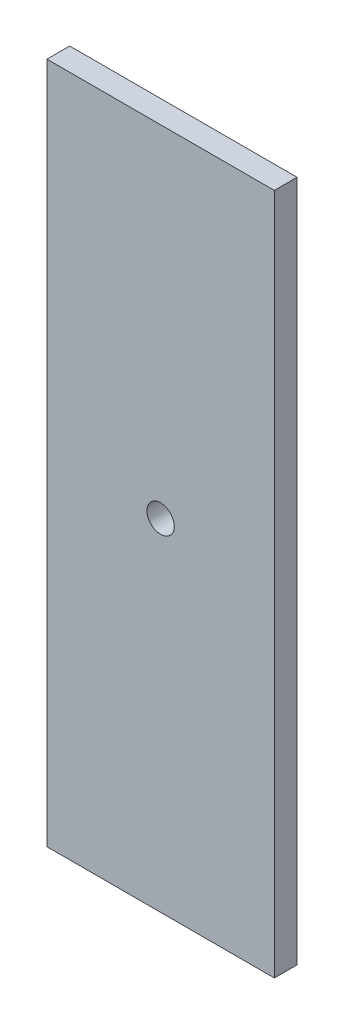
from build123d import *

# Parameters (mm, degrees)
SKETCH1_W           = 50
SKETCH1_H           = 150
BOSS_EXTRUDE1_DEPTH = 5
SKETCH2_R           = 3
CUT_EXTRUDE1_DEPTH  = 80.214897589


with BuildPart() as part:
    # Sketch1 → Boss-Extrude1 (new body)
    with BuildSketch(Plane.XY):
        Rectangle(SKETCH1_W, SKETCH1_H)
    extrude(amount=BOSS_EXTRUDE1_DEPTH)

    # Sketch2 → Cut-Extrude1 (cut, through all)
    with BuildSketch(Plane.XY.offset(5)):
        Circle(SKETCH2_R)
    extrude(amount=-CUT_EXTRUDE1_DEPTH, mode=Mode.SUBTRACT)


solid = part.part
